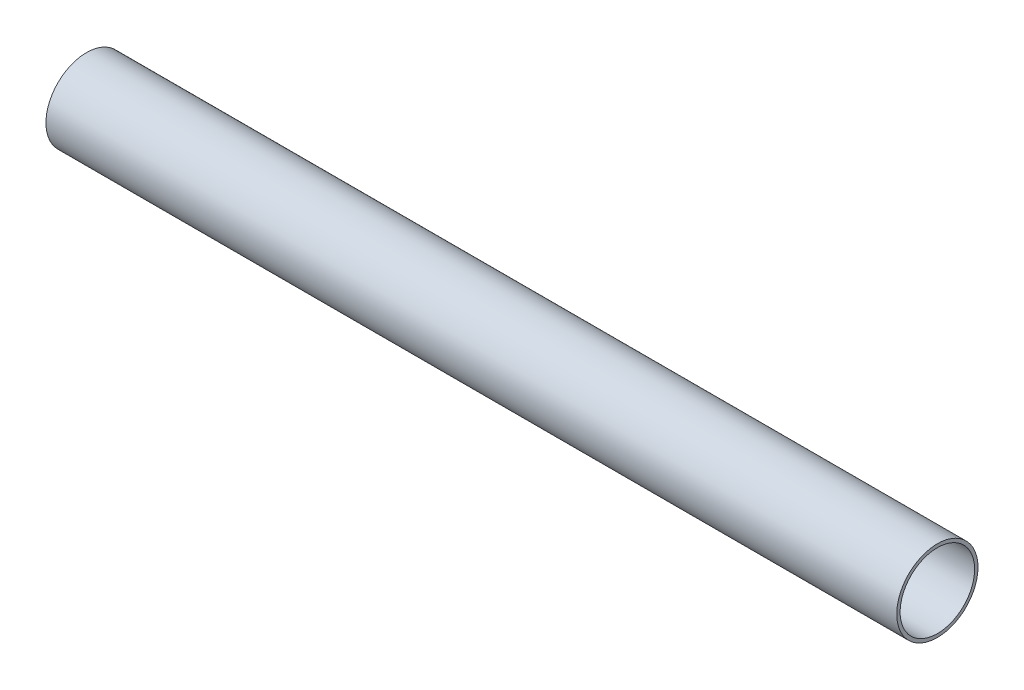
from build123d import *

# Parameters (mm, degrees)
SKETCH1_R           = 19.05
SKETCH1_R_2         = 17.4625
BOSS_EXTRUDE1_DEPTH = 398.8308


with BuildPart() as part:
    # Sketch1 → Boss-Extrude1 (new body)
    with BuildSketch(Plane(origin=(0, 0, 0), x_dir=(0, 0, -1), z_dir=(1, 0, 0))):
        Circle(SKETCH1_R)
        Circle(SKETCH1_R_2, mode=Mode.SUBTRACT)
    extrude(amount=BOSS_EXTRUDE1_DEPTH)


solid = part.part
